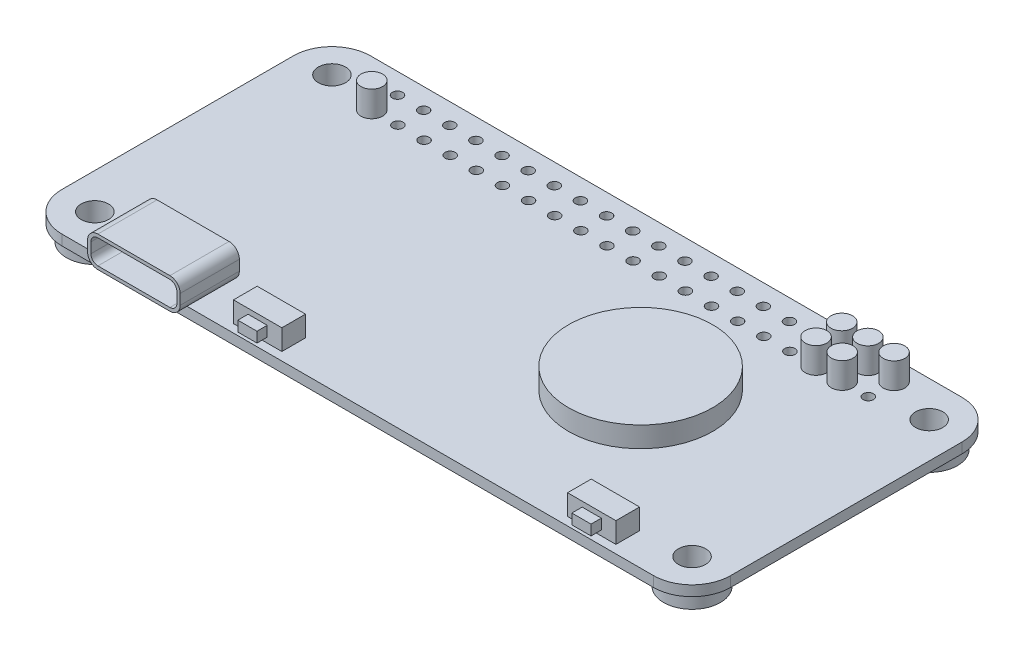
from build123d import *

# Parameters (mm, degrees)
BOSS_EXTRUDE1_DEPTH      = 1
SKETCH2_R                = 1.325
CUT_EXTRUDE1_DEPTH       = 36.80851854
SKETCH3_R                = 0.5
CUT_EXTRUDE2_DEPTH       = 36.80851854
LPATTERN1_COUNT          = 20
LPATTERN1_PITCH          = 2.54
BOSS_EXTRUDE6_DEPTH      = 1.25
BOSS_EXTRUDE6_DEPTH_BACK = 4.5
CUT_EXTRUDE9_DEPTH       = 5.25
SKETCH_1_W               = 4.7
SKETCH_1_H               = 2.3
EXTRUDE_1_DEPTH          = 2
SKETCH_2_W               = 1.86
SKETCH_2_H               = 1
EXTRUDE_2_DEPTH          = 1
SKETCH_9_R               = 2.75
SKETCH_9_R_2             = 1.325
EXTRUDE_8_DEPTH          = 1.5
SKETCH_10_R              = 1.05
EXTRUDE_9_DEPTH          = 2.5
SKETCH_11_R              = 0.5
EXTRUDE_10_DEPTH         = 3
SKETCH_12_R              = 7
EXTRUDE_11_DEPTH         = 2


with BuildPart() as part:
    # Sketch1 → Boss-Extrude1 (new body)
    with BuildSketch(Plane(origin=(0, 0, 0), x_dir=(1, 0, 0), z_dir=(0, 1, 0))):
        with BuildLine():
            Line((-28.75, 15), (28.75, 15))
            ThreePointArc((28.75, 15), (31.401650429, 13.901650429), (32.5, 11.25))
            Line((32.5, 11.25), (32.5, -11.25))
            ThreePointArc((32.5, -11.25), (31.401650429, -13.901650429), (28.75, -15))
            Line((28.75, -15), (-28.75, -15))
            ThreePointArc((-28.75, -15), (-31.401650429, -13.901650429), (-32.5, -11.25))
            Line((-32.5, -11.25), (-32.5, 11.25))
            ThreePointArc((-32.5, 11.25), (-31.401650429, 13.901650429), (-28.75, 15))
        make_face()
    extrude(amount=BOSS_EXTRUDE1_DEPTH)

    # Sketch2 → Cut-Extrude1 (cut, through all)
    with BuildSketch(Plane(origin=(0, 1, 0), x_dir=(1, 0, 0), z_dir=(0, 1, 0))):
        with Locations(Location((-29.025, 11.525, 0), (0, 0, 270))):
            Circle(SKETCH2_R)
        with Locations(Location((29.025, 11.525, 0), (0, 0, 90))):
            Circle(SKETCH2_R)
        with Locations(Location((29.025, -11.525, 0), (0, 0, 270))):
            Circle(SKETCH2_R)
        with Locations(Location((-29.025, -11.525, 0), (0, 0, 90))):
            Circle(SKETCH2_R)
    extrude(amount=-CUT_EXTRUDE1_DEPTH, mode=Mode.SUBTRACT)

    # Sketch3 → Cut-Extrude2 (cut, through all)
    with BuildSketch(Plane(origin=(0, 1, 0), x_dir=(1, 0, 0), z_dir=(0, 1, 0))):
        with Locations(Location((-24.128, 13, 0), (0, 0, 270))):
            Circle(SKETCH3_R)
        with Locations(Location((-24.128, 10.5, 0), (0, 0, 270))):
            Circle(SKETCH3_R)
    cut_extrude2 = extrude(amount=-CUT_EXTRUDE2_DEPTH, mode=Mode.SUBTRACT)

    # LPattern1: Cut-Extrude2 ×20
    with Locations(*[(i * LPATTERN1_PITCH, 0, 0) for i in range(1, LPATTERN1_COUNT)]):
        add(cut_extrude2, mode=Mode.SUBTRACT)

    # Sketch15 → Boss-Extrude6 (add, two sides: drawn at the far end of the back side and taken through both)
    with BuildSketch(Plane.XY.offset(15).offset(-BOSS_EXTRUDE6_DEPTH_BACK)):
        with BuildLine():
            Line((-24, 4), (-17, 4))
            ThreePointArc((-17, 4), (-16.292893219, 3.707106781), (-16, 3))
            Line((-16, 3), (-16, 2))
            ThreePointArc((-16, 2), (-16.292893219, 1.292893219), (-17, 1))
            Line((-17, 1), (-24, 1))
            ThreePointArc((-24, 1), (-24.707106781, 1.292893219), (-25, 2))
            Line((-25, 2), (-25, 3))
            ThreePointArc((-25, 3), (-24.707106781, 3.707106781), (-24, 4))
        make_face()
    extrude(amount=BOSS_EXTRUDE6_DEPTH + BOSS_EXTRUDE6_DEPTH_BACK)

    # Sketch16 → Cut-Extrude9 (cut)
    with BuildSketch(Plane.XY.offset(16.25)):
        with BuildLine():
            Line((-17, 3.68), (-24, 3.68))
            ThreePointArc((-24, 3.68), (-24.480832611, 3.480832611), (-24.68, 3))
            Line((-24.68, 3), (-24.68, 2))
            ThreePointArc((-24.68, 2), (-24.480832611, 1.519167389), (-24, 1.32))
            Line((-24, 1.32), (-17, 1.32))
            ThreePointArc((-17, 1.32), (-16.519167389, 1.519167389), (-16.32, 2))
            Line((-16.32, 2), (-16.32, 3))
            ThreePointArc((-16.32, 3), (-16.519167389, 3.480832611), (-17, 3.68))
        make_face()
    extrude(amount=-CUT_EXTRUDE9_DEPTH, mode=Mode.SUBTRACT)

    # 草图1 → 凸台-拉伸1 (add)
    with BuildSketch(Plane(origin=(0, 1, 0), x_dir=(1, 0, 0), z_dir=(0, 1, 0))):
        with Locations((-10.52, -13.05)):
            Rectangle(SKETCH_1_W, SKETCH_1_H)
        with Locations((21.95, -13.05)):
            Rectangle(SKETCH_1_W, SKETCH_1_H)
    extrude(amount=EXTRUDE_1_DEPTH)

    # 草图2 → 凸台-拉伸2 (add)
    with BuildSketch(Plane.XY.offset(14.2)):
        with Locations((-10.52, 2)):
            Rectangle(SKETCH_2_W, SKETCH_2_H)
        with Locations((21.95, 2)):
            Rectangle(SKETCH_2_W, SKETCH_2_H)
    extrude(amount=EXTRUDE_2_DEPTH)

    # 草图9 → 凸台-拉伸8 (add)
    # profile 1 of 4: a face of its own
    with BuildSketch(Plane.XZ):
        with Locations(Location((29.025, 11.525, 0), (0, 0, 90))):
            Circle(SKETCH_9_R)
        with Locations(Location((29.025, 11.525, 0), (0, 0, 90))):
            Circle(SKETCH_9_R_2, mode=Mode.SUBTRACT)
    # profile 2 of 4: a face of its own
    with BuildSketch(Plane.XZ):
        with Locations(Location((29.025, -11.525, 0), (0, 0, 90))):
            Circle(SKETCH_9_R)
        with Locations(Location((29.025, -11.525, 0), (0, 0, 270))):
            Circle(SKETCH_9_R_2, mode=Mode.SUBTRACT)
    # profile 3 of 4: a face of its own
    with BuildSketch(Plane.XZ):
        with Locations(Location((-29.025, 11.525, 0), (0, 0, 90))):
            Circle(SKETCH_9_R)
        with Locations(Location((-29.025, 11.525, 0), (0, 0, 270))):
            Circle(SKETCH_9_R_2, mode=Mode.SUBTRACT)
    # profile 4 of 4: a face of its own
    with BuildSketch(Plane.XZ):
        with Locations(Location((-29.025, -11.525, 0), (0, 0, 90))):
            Circle(SKETCH_9_R)
        with Locations(Location((-29.025, -11.525, 0), (0, 0, 90))):
            Circle(SKETCH_9_R_2, mode=Mode.SUBTRACT)
    extrude(amount=EXTRUDE_8_DEPTH)

    # 草图10 → 凸台-拉伸9 (add)
    with BuildSketch(Plane(origin=(0, 1, 0), x_dir=(1, 0, 0), z_dir=(0, 1, 0))):
        with Locations(Location((24.132, 13, 0), (0, 0, 270))):
            Circle(SKETCH_10_R)
        with Locations(Location((21.592, 13, 0), (0, 0, 270))):
            Circle(SKETCH_10_R)
        with Locations(Location((19.052, 13, 0), (0, 0, 270))):
            Circle(SKETCH_10_R)
        with Locations(Location((21.592, 10.5, 0), (0, 0, 270))):
            Circle(SKETCH_10_R)
        with Locations(Location((19.052, 10.5, 0), (0, 0, 270))):
            Circle(SKETCH_10_R)
        with Locations(Location((-24.128, 10.5, 0), (0, 0, 270))):
            Circle(SKETCH_10_R)
    extrude(amount=EXTRUDE_9_DEPTH)

    # 草图11 → 凸台-拉伸10 (add)
    with BuildSketch(Plane.XZ.offset(-1)):
        with Locations(Location((24.132, -13, 0), (0, 0, 90))):
            Circle(SKETCH_11_R)
        with Locations(Location((21.592, -13, 0), (0, 0, 90))):
            Circle(SKETCH_11_R)
        with Locations(Location((21.592, -10.5, 0), (0, 0, 90))):
            Circle(SKETCH_11_R)
        with Locations(Location((19.052, -10.5, 0), (0, 0, 90))):
            Circle(SKETCH_11_R)
        with Locations(Location((19.052, -13, 0), (0, 0, 90))):
            Circle(SKETCH_11_R)
        with Locations(Location((-24.128, -10.5, 0), (0, 0, 90))):
            Circle(SKETCH_11_R)
    extrude(amount=EXTRUDE_10_DEPTH)

    # 草图12 → 凸台-拉伸11 (add)
    with BuildSketch(Plane(origin=(0, 1, 0), x_dir=(1, 0, 0), z_dir=(0, 1, 0))):
        with Locations(Location((12.5, 0, 0), (0, 0, 270))):
            Circle(SKETCH_12_R)
    extrude(amount=EXTRUDE_11_DEPTH)


solid = part.part
